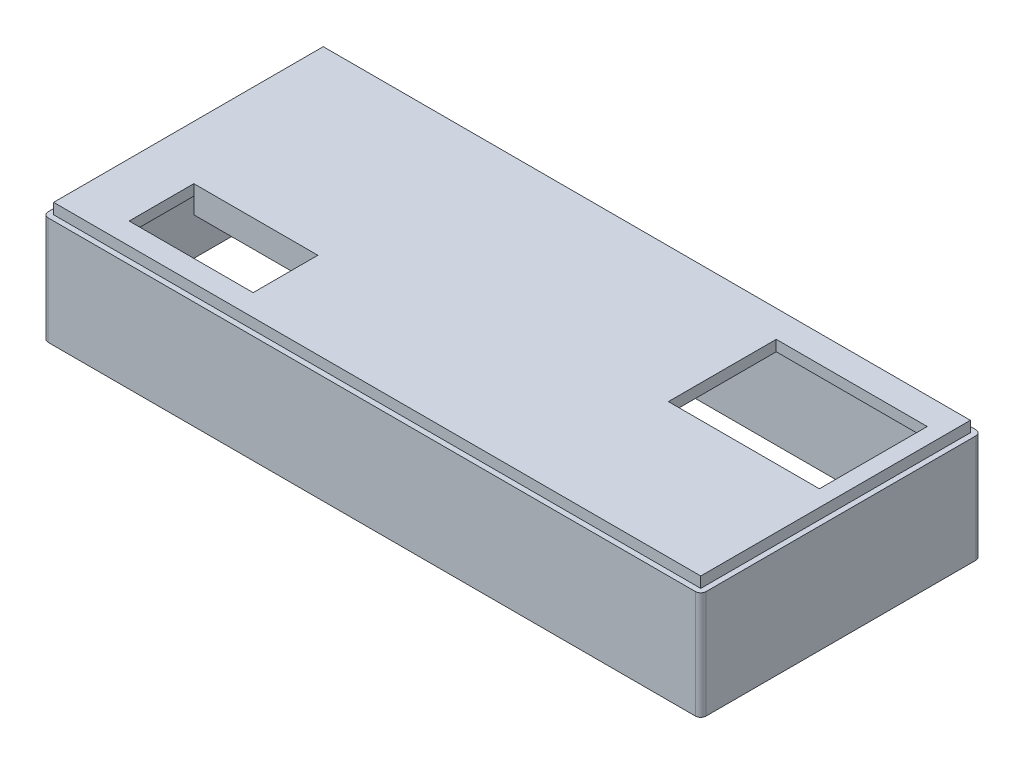
from build123d import *

# Parameters (mm, degrees)
SKETCH_1_W          = 120
SKETCH_1_H          = 50
EXTRUDE_1_DEPTH     = 2
SKETCH_2_W          = 122
SKETCH_2_H          = 52
SKETCH_2_W_2        = 120
SKETCH_2_H_2        = 50
EXTRUDE_2_DEPTH     = 20
SKETCH_3_W          = 28
SKETCH_3_H          = 20
CUT_EXTRUDE_1_DEPTH = 2
FILLET_2_R          = 1
EXTRUDE_2_2_DEPTH   = 3
SKETCH_6_W          = 23
SKETCH_6_H          = 12
CUT_EXTRUDE_2_DEPTH = 2


with BuildPart() as part:
    # 草图1 → 凸台-拉伸1 (new body)
    with BuildSketch(Plane(origin=(0, 0, 0), x_dir=(1, 0, 0), z_dir=(0, 1, 0))):
        with Locations((60, -25)):
            Rectangle(SKETCH_1_W, SKETCH_1_H)
    extrude(amount=EXTRUDE_1_DEPTH)

    # 草图3 → 切除-拉伸1 (cut)
    with BuildSketch(Plane(origin=(0, 2, 0), x_dir=(1, 0, 0), z_dir=(0, 1, 0))):
        with Locations((103, -15)):
            Rectangle(SKETCH_3_W, SKETCH_3_H)
    extrude(amount=-CUT_EXTRUDE_1_DEPTH, mode=Mode.SUBTRACT)

    # 草图5 → Extrude 2 2 (add)
    with BuildSketch(Plane.XZ):
        Polygon((10, 33), (34, 33), (34, 47), (10, 47), (10, 46), (33, 46), (33, 34), (10, 34), align=None)
    extrude(amount=EXTRUDE_2_2_DEPTH)

    # 草图6 → 切除-拉伸2 (cut)
    with BuildSketch(Plane.XZ):
        with Locations((21.5, 40)):
            Rectangle(SKETCH_6_W, SKETCH_6_H)
    extrude(amount=-CUT_EXTRUDE_2_DEPTH, mode=Mode.SUBTRACT)


with BuildPart() as body_2:
    # 草图2 → Extrude 2 (new body)
    with BuildSketch(Plane.XZ):
        with Locations((60, 25)):
            Rectangle(SKETCH_2_W, SKETCH_2_H)
        with Locations((60, 25)):
            Rectangle(SKETCH_2_W_2, SKETCH_2_H_2, mode=Mode.SUBTRACT)
    extrude(amount=EXTRUDE_2_DEPTH)

    # 圆角2
    fillet_2_edges = [body_2.edges().sort_by_distance(p)[0] for p in [
        (120, -10, 0),
        (120, -10, 50),
        (0, -10, 50),
        (0, -10, 0),
        (121, -10, -1),
        (-1, -10, -1),
        (-1, -10, 51),
        (121, -10, 51),
    ]]
    fillet(fillet_2_edges, radius=FILLET_2_R)


solid = Compound([part.part, body_2.part])
